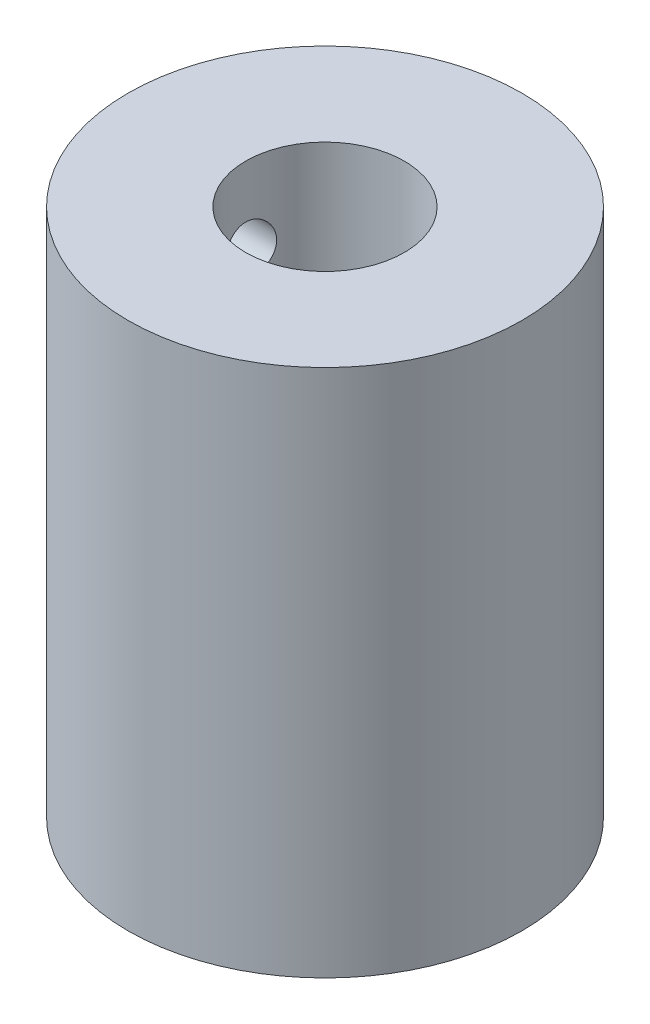
from build123d import *

# Parameters (mm, degrees)
SKETCH1_R               = 7.45
BOSS_EXTRUDE1_DEPTH     = 20
SKETCH2_R               = 3
CUT_EXTRUDE1_DEPTH      = 14
SKETCH3_R               = 2.5
CUT_EXTRUDE2_DEPTH      = 6
CUT_EXTRUDE3_REACH      = 24.605
CUT_EXTRUDE3_END_RADIUS = 7.45
SKETCH4_R               = 1
CUT_EXTRUDE4_REACH      = 24.605
CUT_EXTRUDE4_END_RADIUS = 7.45
SKETCH6_R               = 1


with BuildPart() as part:
    # Sketch1 → Boss-Extrude1 (new body)
    with BuildSketch(Plane(origin=(0, 0, 0), x_dir=(1, 0, 0), z_dir=(0, 1, 0))):
        with Locations(Location((0, 0, 0), (0, 0, 270))):
            Circle(SKETCH1_R)
    extrude(amount=BOSS_EXTRUDE1_DEPTH)

    # Sketch2 → Cut-Extrude1 (cut)
    with BuildSketch(Plane(origin=(0, 20, 0), x_dir=(1, 0, 0), z_dir=(0, 1, 0))):
        with Locations(Location((0, 0, 0), (0, 0, 270))):
            Circle(SKETCH2_R)
    extrude(amount=-CUT_EXTRUDE1_DEPTH, mode=Mode.SUBTRACT)

    # Sketch3 → Cut-Extrude2 (cut)
    with BuildSketch(Plane.XZ):
        with Locations(Location((0, 0, 0), (0, 0, 270))):
            Circle(SKETCH3_R)
    extrude(amount=-CUT_EXTRUDE2_DEPTH, mode=Mode.SUBTRACT)

    # Cut-Extrude3: up to this cylinder (the profile starts inside it)
    cut_extrude3_end = Plane(origin=(0, 17, 0), z_dir=(0, -1, 0)) * Cylinder(CUT_EXTRUDE3_END_RADIUS, 65.11, mode=Mode.PRIVATE)
    # Sketch4 → Cut-Extrude3 (cut, up to the surface)
    with BuildSketch(Plane(origin=(0, 0, 0), x_dir=(0, 0, -1), z_dir=(1, 0, 0)), mode=Mode.PRIVATE) as cut_extrude3_sk1:
        with Locations((0, 17)):
            Circle(SKETCH4_R)
    cut_extrude3_tool1 = extrude(cut_extrude3_sk1.sketch, amount=-CUT_EXTRUDE3_REACH, mode=Mode.PRIVATE) & cut_extrude3_end
    add(cut_extrude3_tool1.solids().sort_by_distance((0, 17, 0))[0], mode=Mode.SUBTRACT)

    # Cut-Extrude4: up to this cylinder (the profile starts inside it)
    cut_extrude4_end = Plane(origin=(0, 3, 0), z_dir=(0, -1, 0)) * Cylinder(CUT_EXTRUDE4_END_RADIUS, 65.11, mode=Mode.PRIVATE)
    # Sketch6 → Cut-Extrude4 (cut, up to the surface)
    with BuildSketch(Plane.XY, mode=Mode.PRIVATE) as cut_extrude4_sk1:
        with Locations((0, 3)):
            Circle(SKETCH6_R)
    cut_extrude4_tool1 = extrude(cut_extrude4_sk1.sketch, amount=-CUT_EXTRUDE4_REACH, mode=Mode.PRIVATE) & cut_extrude4_end
    add(cut_extrude4_tool1.solids().sort_by_distance((0, 3, 0))[0], mode=Mode.SUBTRACT)


solid = part.part
